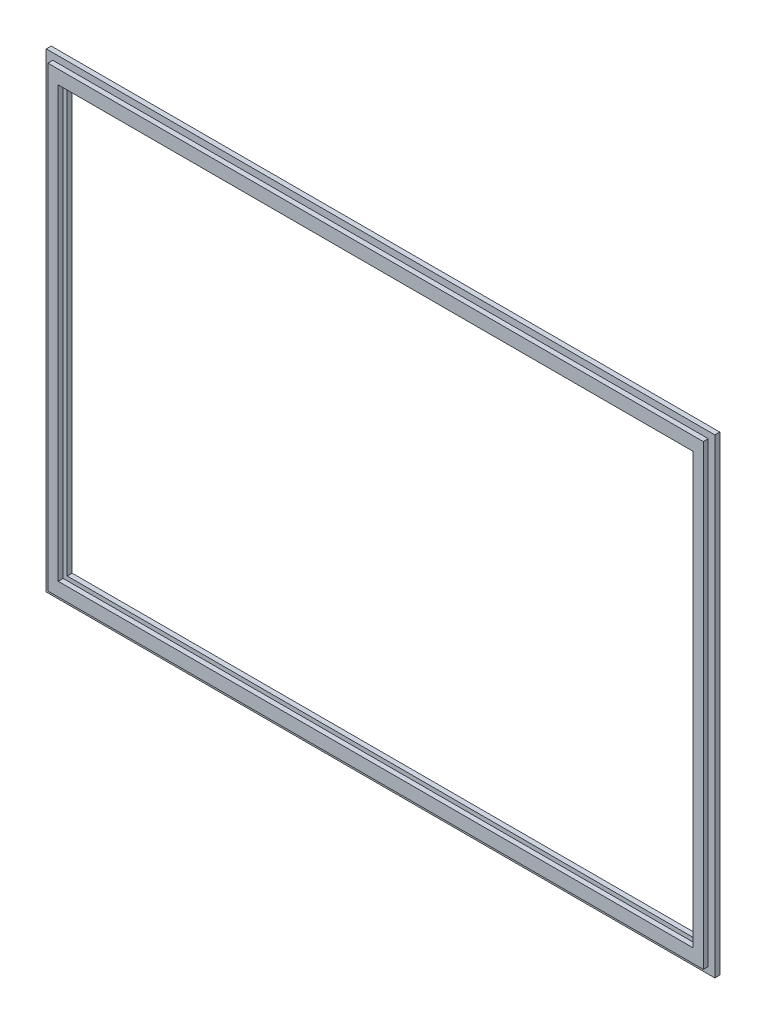
from build123d import *

# Parameters (mm, degrees)
SKETCH1_W           = 79.5
SKETCH1_H           = 55.45
SKETCH1_W_2         = 77
SKETCH1_H_2         = 52.15
BOSS_EXTRUDE1_DEPTH = 0.6
SKETCH2_W           = 81.1
SKETCH2_H           = 57.05
SKETCH2_W_2         = 76
SKETCH2_H_2         = 51.15
BOSS_EXTRUDE2_DEPTH = 0.6


with BuildPart() as part:
    # Sketch1 → Boss-Extrude1 (new body)
    with BuildSketch(Plane.XY):
        Rectangle(SKETCH1_W, SKETCH1_H)
        Rectangle(SKETCH1_W_2, SKETCH1_H_2, mode=Mode.SUBTRACT)
    extrude(amount=BOSS_EXTRUDE1_DEPTH)

    # Sketch2 → Boss-Extrude2 (add)
    with BuildSketch(Plane(origin=(0, 0, 0), x_dir=(-1, 0, 0), z_dir=(0, 0, -1))):
        Rectangle(SKETCH2_W, SKETCH2_H)
        Rectangle(SKETCH2_W_2, SKETCH2_H_2, mode=Mode.SUBTRACT)
    extrude(amount=BOSS_EXTRUDE2_DEPTH)


solid = part.part
